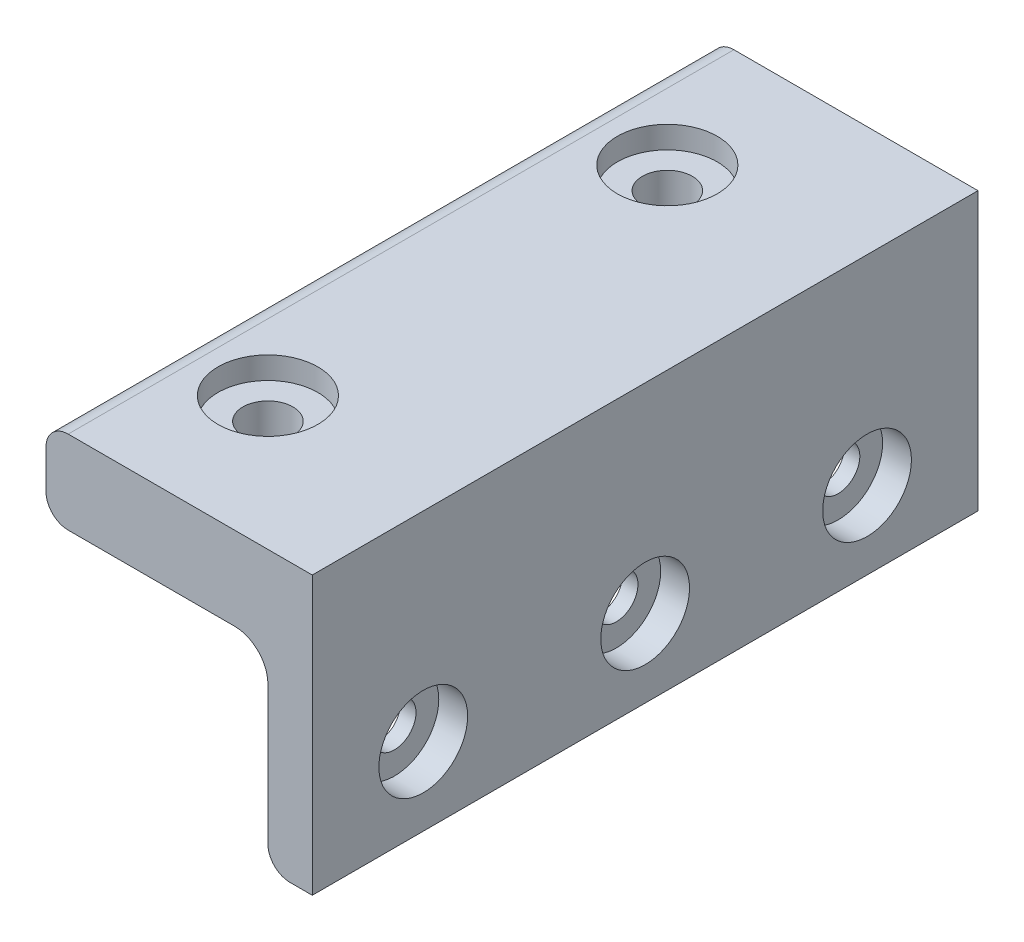
from build123d import *

# Parameters (mm, degrees)
EXTRUDE1_DEPTH                                     = 60
CBORE_FOR_M3_5_PAN_HEAD_MACHINE_SCREW1_D           = 3.9
CBORE_FOR_M3_5_PAN_HEAD_MACHINE_SCREW1_CBORE_D     = 8
CBORE_FOR_M3_5_PAN_HEAD_MACHINE_SCREW1_CBORE_DEPTH = 2.6
CBORE_FOR_M4_PAN_HEAD_MACHINE_SCREW1_D             = 4.5
CBORE_FOR_M4_PAN_HEAD_MACHINE_SCREW1_CBORE_D       = 9
CBORE_FOR_M4_PAN_HEAD_MACHINE_SCREW1_CBORE_DEPTH   = 2


with BuildPart() as part:
    # Sketch1 → Extrude1 (new body)
    with BuildSketch(Plane.XY):
        with BuildLine():
            Line((-22, 0), (0, 0))
            Line((0, 0), (0, -25))
            Line((0, -25), (-2, -25))
            ThreePointArc((-2, -25), (-3.414213562, -24.414213562), (-4, -23))
            Line((-4, -23), (-4, -10.5))
            ThreePointArc((-4, -10.5), (-4.878679656, -8.378679656), (-7, -7.5))
            Line((-7, -7.5), (-22, -7.5))
            ThreePointArc((-22, -7.5), (-23.414213562, -6.914213562), (-24, -5.5))
            Line((-24, -5.5), (-24, -2))
            ThreePointArc((-24, -2), (-23.414213562, -0.585786438), (-22, 0))
        make_face()
    extrude(amount=-EXTRUDE1_DEPTH)

    # CBORE for M3.5 Pan Head Machine Screw1 (through all)
    with Locations(Plane(origin=(0, 0, 0), x_dir=(0, 0, -1), z_dir=(1, 0, 0))):
        with Locations((50, -18), (30, -18), (10, -18)):
            CounterBoreHole(CBORE_FOR_M3_5_PAN_HEAD_MACHINE_SCREW1_D / 2, CBORE_FOR_M3_5_PAN_HEAD_MACHINE_SCREW1_CBORE_D / 2, CBORE_FOR_M3_5_PAN_HEAD_MACHINE_SCREW1_CBORE_DEPTH)

    # CBORE for M4 Pan Head Machine Screw1 (through all)
    with Locations(Plane(origin=(0, 0, 0), x_dir=(-1, 0, 0), z_dir=(0, 1, 0))):
        with Locations((16, -48), (16, -12)):
            CounterBoreHole(CBORE_FOR_M4_PAN_HEAD_MACHINE_SCREW1_D / 2, CBORE_FOR_M4_PAN_HEAD_MACHINE_SCREW1_CBORE_D / 2, CBORE_FOR_M4_PAN_HEAD_MACHINE_SCREW1_CBORE_DEPTH)


solid = part.part
